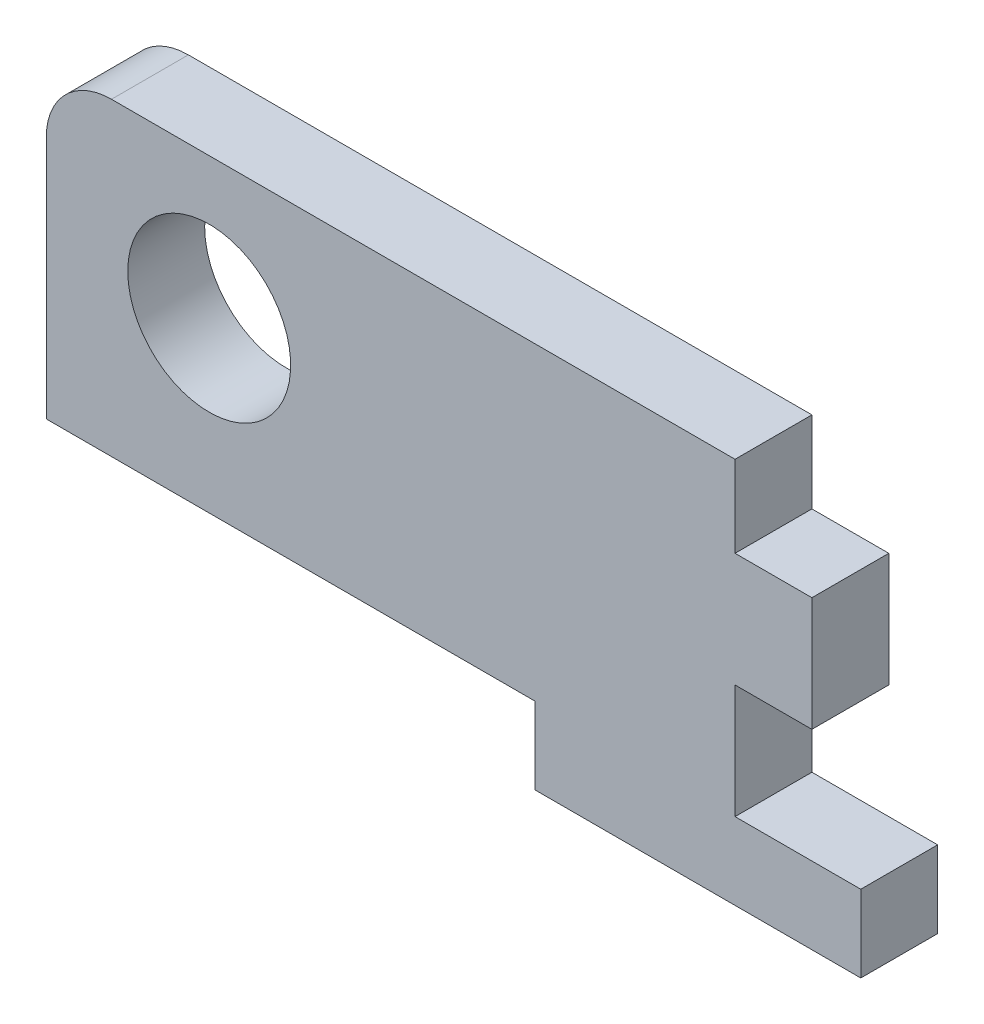
from build123d import *

# Parameters (mm, degrees)
SKETCH1_R           = 3.175
BOSS_EXTRUDE1_DEPTH = 2.9972


with BuildPart() as part:
    # Sketch1 → Boss-Extrude1 (new body)
    with BuildSketch(Plane.XY):
        with BuildLine():
            Line((38.1, -2.9972), (50.8, -2.9972))
            Line((50.8, -2.9972), (50.8, 0))
            Line((50.8, 0), (45.8978, 0))
            Line((45.8978, 0), (45.8978, 4.445))
            Line((45.8978, 4.445), (48.895, 4.445))
            Line((48.895, 4.445), (48.895, 8.89))
            Line((48.895, 8.89), (45.8978, 8.89))
            Line((45.8978, 8.89), (45.8978, 12.065))
            Line((45.8978, 12.065), (21.59, 12.065))
            ThreePointArc((21.59, 12.065), (19.793948776, 11.321051224), (19.05, 9.525))
            Line((19.05, 9.525), (19.05, 0))
            Line((19.05, 0), (38.1, 0))
            Line((38.1, 0), (38.1, -2.9972))
        make_face()
        with Locations((25.4, 6.5778)):
            Circle(SKETCH1_R, mode=Mode.SUBTRACT)
    extrude(amount=BOSS_EXTRUDE1_DEPTH)


solid = part.part
